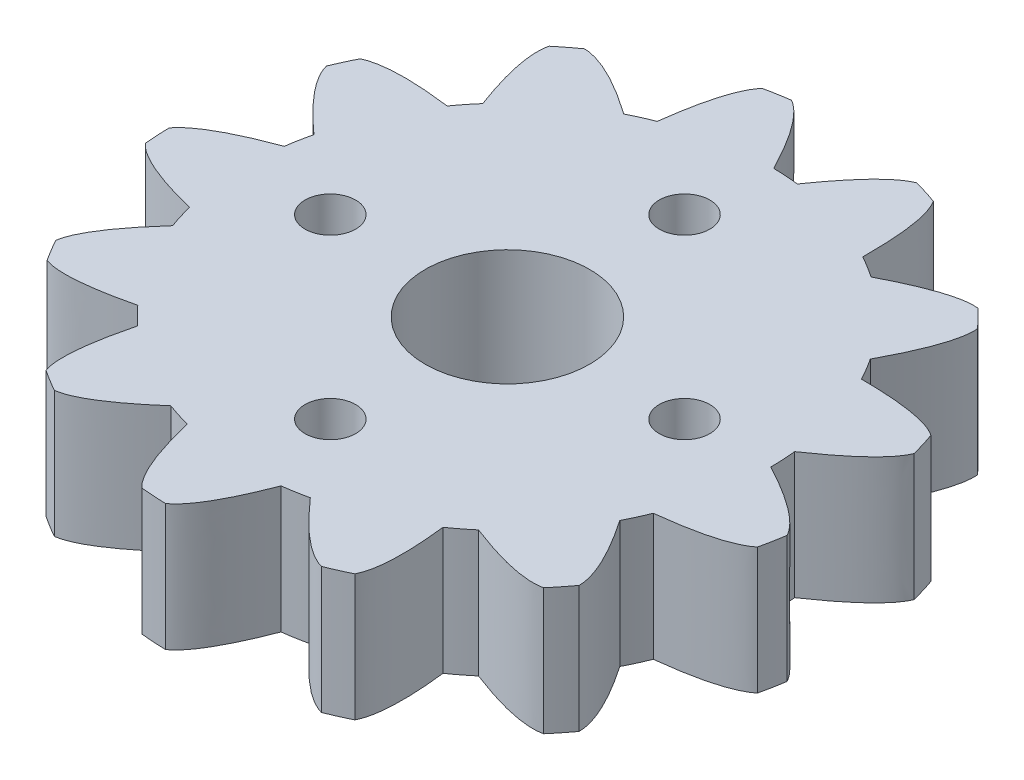
from build123d import *

# Parameters (mm, degrees)
SKETCH1_R           = 10.345071301
BOSS_EXTRUDE4_DEPTH = 5
CIRPATTERN6_COUNT   = 13
SKETCH2_R           = 3.25
CUT_EXTRUDE1_DEPTH  = 10
SKETCH5_R           = 1
CUT_EXTRUDE2_DEPTH  = 10
CIRPATTERN7_COUNT   = 4


with BuildPart() as part:
    # Sketch1 → Boss-Extrude4 (new body)
    with BuildSketch(Plane(origin=(0, 0, 0), x_dir=(1, 0, 0), z_dir=(0, 1, 0))):
        Circle(SKETCH1_R)
        with BuildLine():
            ThreePointArc((9.698156453, 8.884250796), (9.527501134, 9.067021172), (9.353401927, 9.24651411))
            ThreePointArc((9.353401927, 9.24651411), (9.175921764, 9.422664727), (8.995124799, 9.595409353))
            add(Edge.make_bspline(
                [(8.995124799, 9.595409353), (8.044753126, 9.701772308), (5.822605435, 8.550892712)],
                knots=[0.625782076, 0.625782076, 0.625782076, 1, 1, 1], degree=2))
            ThreePointArc((5.822605435, 8.550892712), (7.356985977, 7.272912591), (8.617247078, 5.723945581))
            add(Edge.make_bspline(
                [(8.617247078, 5.723945581), (9.793589775, 7.932719464), (9.698156453, 8.884250796)],
                knots=[0, 0, 0, 0.374217924, 0.374217924, 0.374217924], degree=2))
        make_face()
    boss_extrude4 = extrude(amount=BOSS_EXTRUDE4_DEPTH)

    # CirPattern6: Boss-Extrude4 ×13 about axis
    cirpattern6_axis = Axis((0, 5, 0), (0, 1, 0))
    for i in range(1, CIRPATTERN6_COUNT):
        add(boss_extrude4.rotate(cirpattern6_axis, i * 360 / CIRPATTERN6_COUNT))

    # Sketch2 → Cut-Extrude1 (cut)
    with BuildSketch(Plane(origin=(0, 5, 0), x_dir=(1, 0, 0), z_dir=(0, 1, 0))):
        with Locations(Location((0, 0, 0), (0, 0, 270))):
            Circle(SKETCH2_R)
    extrude(amount=-CUT_EXTRUDE1_DEPTH, mode=Mode.SUBTRACT)

    # Sketch5 → Cut-Extrude2 (cut)
    with BuildSketch(Plane(origin=(0, 5, 0), x_dir=(1, 0, 0), z_dir=(0, 1, 0))):
        with Locations(Location((7, 0, 0), (0, 0, 270))):
            Circle(SKETCH5_R)
    cut_extrude2 = extrude(amount=-CUT_EXTRUDE2_DEPTH, mode=Mode.SUBTRACT)

    # CirPattern7: Cut-Extrude2 ×4 about axis
    cirpattern7_axis = Axis((0, 0, 0), (0, 1, 0))
    for i in range(1, CIRPATTERN7_COUNT):
        add(cut_extrude2.rotate(cirpattern7_axis, i * 360 / CIRPATTERN7_COUNT), mode=Mode.SUBTRACT)


solid = part.part
